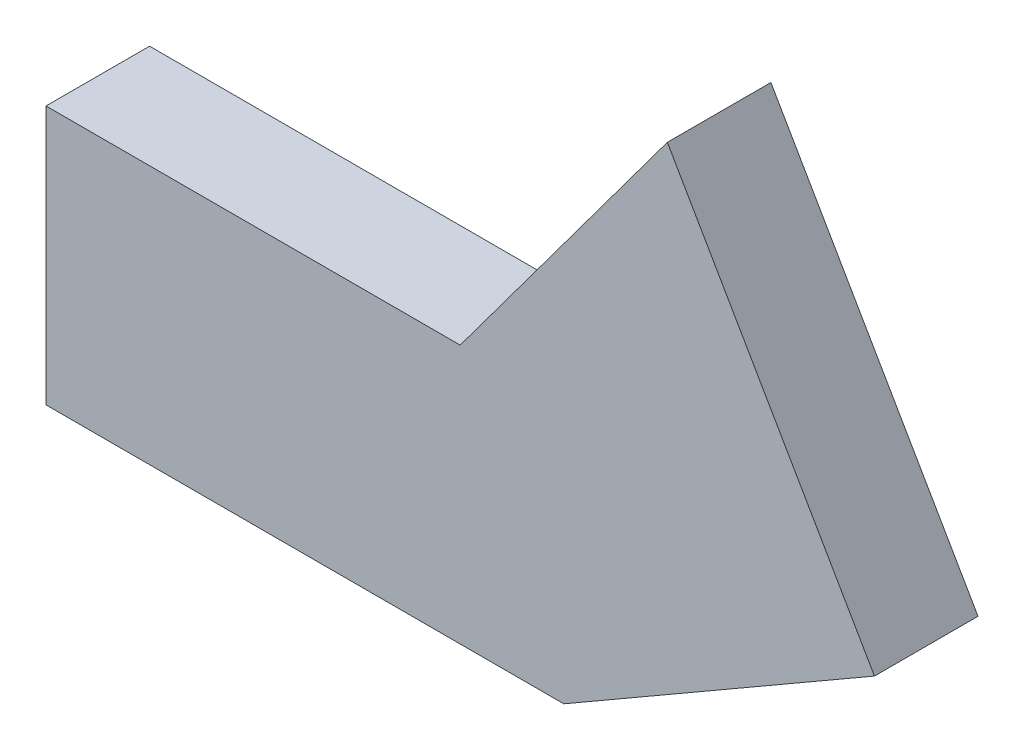
from build123d import *

# Parameters (mm, degrees)
BOSS_EXTRUDE1_DEPTH = 20


with BuildPart() as part:
    # Sketch1 → Boss-Extrude1 (new body)
    with BuildSketch(Plane.XY):
        Polygon((0, 0), (100, 0), (160, 34.641016151), (120, 103.923048454), (80, 50), (0, 50), align=None)
    extrude(amount=BOSS_EXTRUDE1_DEPTH)


solid = part.part
